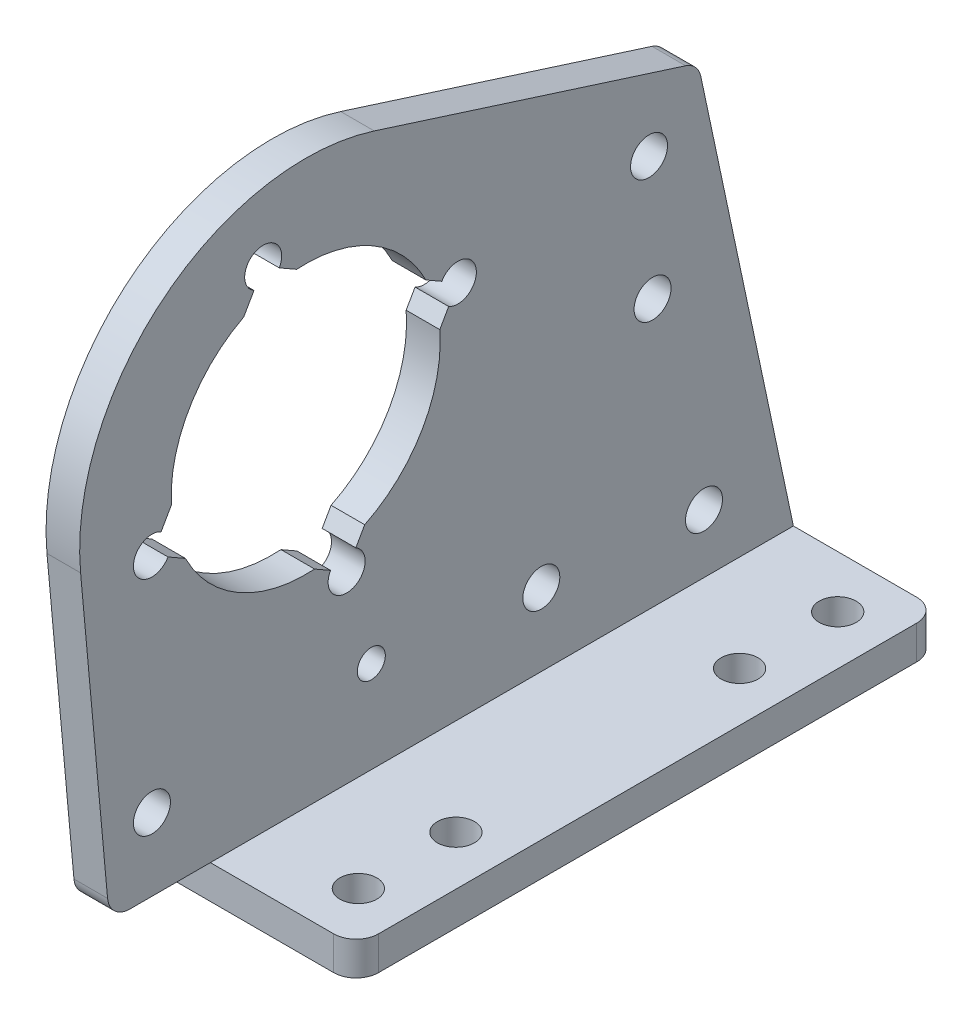
from build123d import *

# Parameters (mm, degrees)
SKETCH_4_R               = 1.65
SKETCH_4_R_2             = 1.25
EXTRUDE_6_DEPTH          = 3
SKETCH_2_W               = 52.000000003
SKETCH_2_H               = 3
EXTRUDE_5_DEPTH          = 16
CUT_EXTRUDE_1_DEPTH      = 81.576384951
CUT_EXTRUDE_1_DEPTH_BACK = 22
SKETCH_3_R               = 1.65
SKETCH_3_R_2             = 1.649999999
FILLET_1_R               = 2


with BuildPart() as part:
    # 草图4 → 凸台-拉伸6 (new body)
    with BuildSketch(Plane(origin=(0, 0, 3), x_dir=(0, 0, -1), z_dir=(1, 0, 0))):
        with BuildLine():
            Line((64.000000003, 13), (55.5, 53))
            Line((55.5, 53), (26.619851504, 62.203688289))
            ThreePointArc((26.619851503, 62.203688284), (7.878186643, 58.714131219), (0.427686687, 41.166565559))
            Line((0.427686681, 41.166565558), (3, 13))
            Line((3, 13), (64.000000003, 13))
        make_face()
        with BuildLine():
            Line((31.220139039, 48.391717333), (32.643651042, 47.578281902))
            ThreePointArc((32.643651042, 47.578281902), (35.668112531, 47.193796374), (33.257622978, 45.32705147))
            Line((33.257622978, 45.32705147), (32.463156965, 43.936735946))
            ThreePointArc((32.463156965, 43.936735946), (30.918719173, 37.045985317), (25.766171663, 32.217011669))
            Line((25.766171663, 32.217011669), (24.972102707, 30.827390996))
            ThreePointArc((24.972102707, 30.827390996), (24.587617178, 27.802929507), (22.720872274, 30.21341906))
            Line((22.720872274, 30.21341906), (21.298407798, 31.026255903))
            ThreePointArc((21.298407798, 31.026255903), (14.546134211, 32.580734872), (9.778813432, 37.608881256))
            Line((9.778813432, 37.608881256), (8.221211801, 38.49893933))
            ThreePointArc((8.221211801, 38.49893933), (5.196750311, 38.883424859), (7.607239865, 40.750169763))
            Line((7.607239865, 40.750169763), (8.517750445, 42.343563279))
            ThreePointArc((8.517750445, 42.343563279), (10.080883767, 48.953319834), (14.981852498, 53.655741871))
            Line((14.981852498, 53.655741871), (15.892760135, 55.249830237))
            ThreePointArc((15.892760135, 55.249830237), (16.277245664, 58.274291726), (18.143990568, 55.863802173))
            Line((18.143990568, 55.863802173), (19.702639726, 54.973145511))
            ThreePointArc((19.702639726, 54.973145511), (26.453468729, 53.418570279), (31.220139039, 48.391717333))
        make_face(mode=Mode.SUBTRACT)
        with Locations((51.441115069, 36.836873887)):
            Circle(SKETCH_4_R, mode=Mode.SUBTRACT)
        with Locations((41.518336301, 19.472011044)):
            Circle(SKETCH_4_R, mode=Mode.SUBTRACT)
        with Locations((56.026104064, 18.242284788)):
            Circle(SKETCH_4_R, mode=Mode.SUBTRACT)
        with Locations((51.125, 48)):
            Circle(SKETCH_4_R, mode=Mode.SUBTRACT)
        with Locations((6.788610616, 19.472011044)):
            Circle(SKETCH_4_R, mode=Mode.SUBTRACT)
        with Locations((26.354935737, 21.197394906)):
            Circle(SKETCH_4_R_2, mode=Mode.SUBTRACT)
    extrude(amount=EXTRUDE_6_DEPTH)

    # 草图2 → 凸台-拉伸5 (add)
    with BuildSketch(Plane(origin=(0, 0, 0), x_dir=(0, 0, -1), z_dir=(1, 0, 0))):
        with Locations((35.000000001, 11.5)):
            Rectangle(SKETCH_2_W, SKETCH_2_H)
    extrude(amount=EXTRUDE_5_DEPTH)

    # 草图3 → 切除-拉伸1 (cut, two sides: drawn at the far end of the back side and taken through both)
    with BuildSketch(Plane(origin=(0, 13, 0), x_dir=(1, 0, 0), z_dir=(0, 1, 0)).offset(-CUT_EXTRUDE_1_DEPTH_BACK)):
        with Locations(Location((11.6, 13.6, 0), (0, 0, 90))):
            Circle(SKETCH_3_R)
        with Locations(Location((11.6, 22.3, 0), (0, 0, 90))):
            Circle(SKETCH_3_R)
        with Locations(Location((11.6, 56.350000003, 0), (0, 0, 90))):
            Circle(SKETCH_3_R_2)
        with Locations(Location((11.6, 47.6, 0), (0, 0, 90))):
            Circle(SKETCH_3_R)
    extrude(amount=CUT_EXTRUDE_1_DEPTH + CUT_EXTRUDE_1_DEPTH_BACK, mode=Mode.SUBTRACT)

    # 圆角1
    fillet_1_edges = [part.edges().sort_by_distance(p)[0] for p in [
        (16, 11.5, -61.000000003),
        (1.5, 13, 0),
        (1.5, 53, -52.5),
        (16, 11.5, -9),
    ]]
    fillet(fillet_1_edges, radius=FILLET_1_R)


solid = part.part
